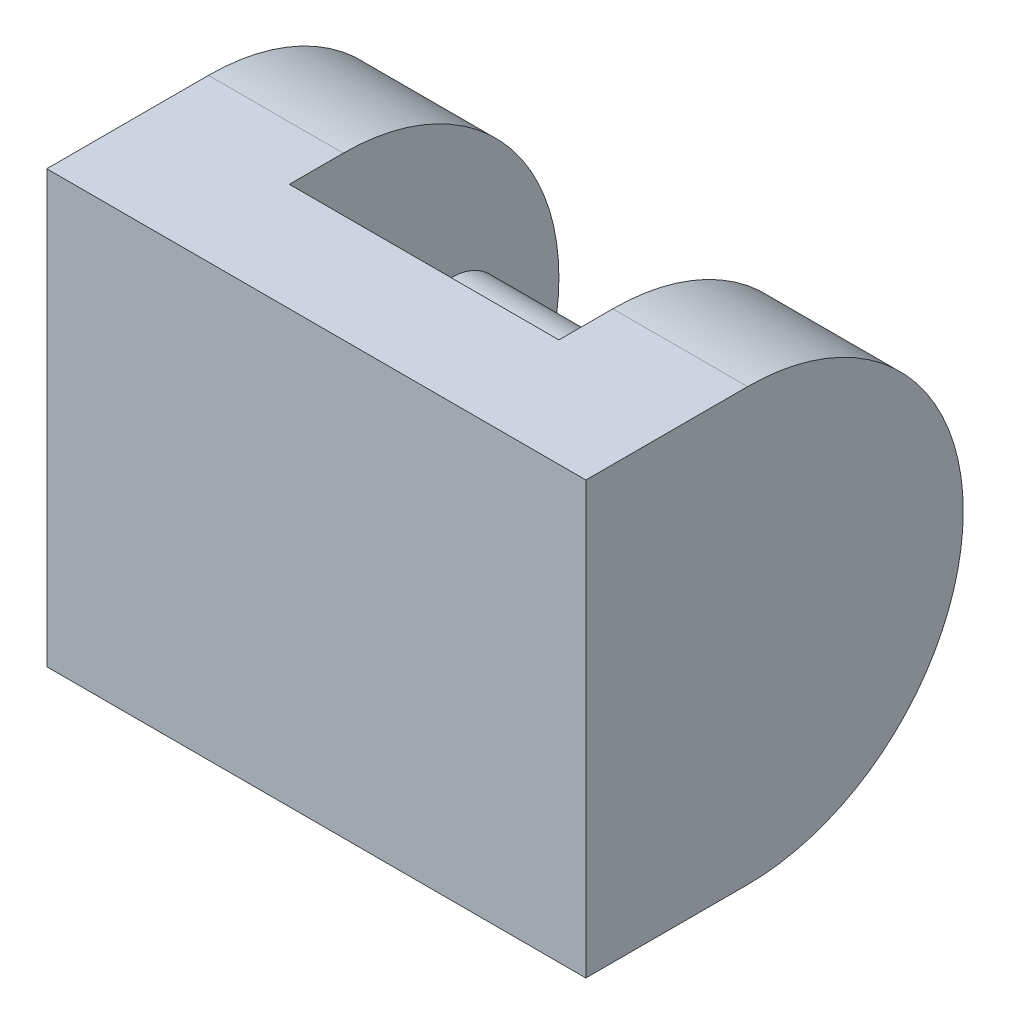
from build123d import *

# Parameters (mm, degrees)
SKETCH_1_W          = 10
SKETCH_1_H          = 8
EXTRUDE_1_DEPTH     = 3
EXTRUDE_2_DEPTH     = 10
SKETCH_4_W          = 5
SKETCH_4_H          = 8
CUT_EXTRUDE_1_DEPTH = 10
SKETCH_5_R          = 1
EXTRUDE_3_DEPTH     = 10
SKETCH_7_W          = 5
SKETCH_7_H          = 1
CUT_EXTRUDE_2_DEPTH = 10


with BuildPart() as part:
    # 草图1 → 凸台-拉伸1 (new body)
    with BuildSketch(Plane.XY):
        Rectangle(SKETCH_1_W, SKETCH_1_H)
    extrude(amount=EXTRUDE_1_DEPTH)

    # 草图3 → 凸台-拉伸2 (add)
    with BuildSketch(Plane(origin=(5, 0, 0), x_dir=(0, 0, -1), z_dir=(1, 0, 0))):
        with BuildLine():
            ThreePointArc((4, 0), (2.828427125, 2.828427125), (0, 4))
            Line((0, 4), (0, -4))
            ThreePointArc((0, -4), (2.828427125, -2.828427125), (4, 0))
        make_face()
    extrude(amount=-EXTRUDE_2_DEPTH)

    # 草图4 → 切除-拉伸1 (cut)
    with BuildSketch(Plane.XY):
        Rectangle(SKETCH_4_W, SKETCH_4_H)
    extrude(amount=-CUT_EXTRUDE_1_DEPTH, mode=Mode.SUBTRACT)

    # 草图5 → 凸台-拉伸3 (add)
    with BuildSketch(Plane.ZY.offset(5)):
        with Locations((-2, 0)):
            Circle(SKETCH_5_R)
    extrude(amount=-EXTRUDE_3_DEPTH)

    # 草图7 → 切除-拉伸2 (cut)
    with BuildSketch(Plane(origin=(0, -4, 0), x_dir=(-1, 0, 0), z_dir=(0, -1, 0))):
        with Locations((0, -0.5)):
            Rectangle(SKETCH_7_W, SKETCH_7_H)
    extrude(amount=-CUT_EXTRUDE_2_DEPTH, mode=Mode.SUBTRACT)


solid = part.part
